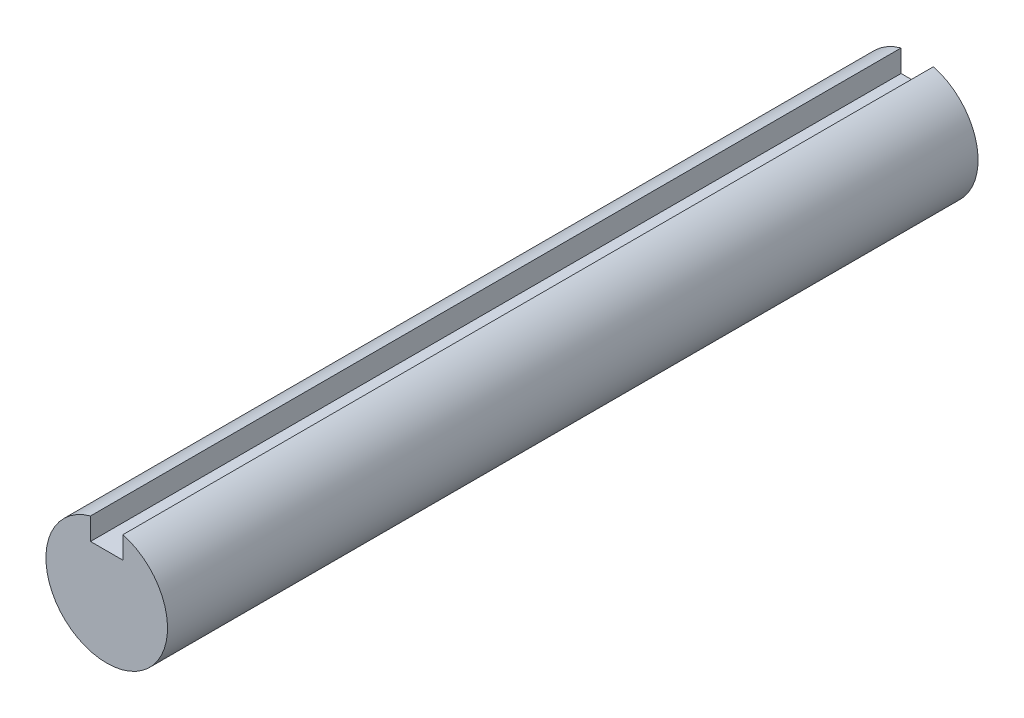
from build123d import *

# Parameters (mm, degrees)
SKETCH1_R           = 0.75
BOSS_EXTRUDE1_DEPTH = 10
SKETCH3_W           = 0.2
SKETCH3_H           = 0.357534677
CUT_EXTRUDE1_DEPTH  = 11.056092681


with BuildPart() as part:
    # Sketch1 → Boss-Extrude1 (new body)
    with BuildSketch(Plane.XY):
        Circle(SKETCH1_R)
    extrude(amount=BOSS_EXTRUDE1_DEPTH)

    # Sketch3 → Cut-Extrude1 (cut, through all)
    with BuildSketch(Plane.XY.offset(10)):
        with Locations((0.1, 0.628767338)):
            Rectangle(SKETCH3_W, SKETCH3_H)
    cut_extrude1 = extrude(amount=-CUT_EXTRUDE1_DEPTH, mode=Mode.SUBTRACT)

    # Mirror1: Cut-Extrude1 across plane
    add(cut_extrude1.mirror(Plane(origin=(0, 0, 0), x_dir=(0, 0, 1), z_dir=(1, 0, 0))), mode=Mode.SUBTRACT)


solid = part.part
